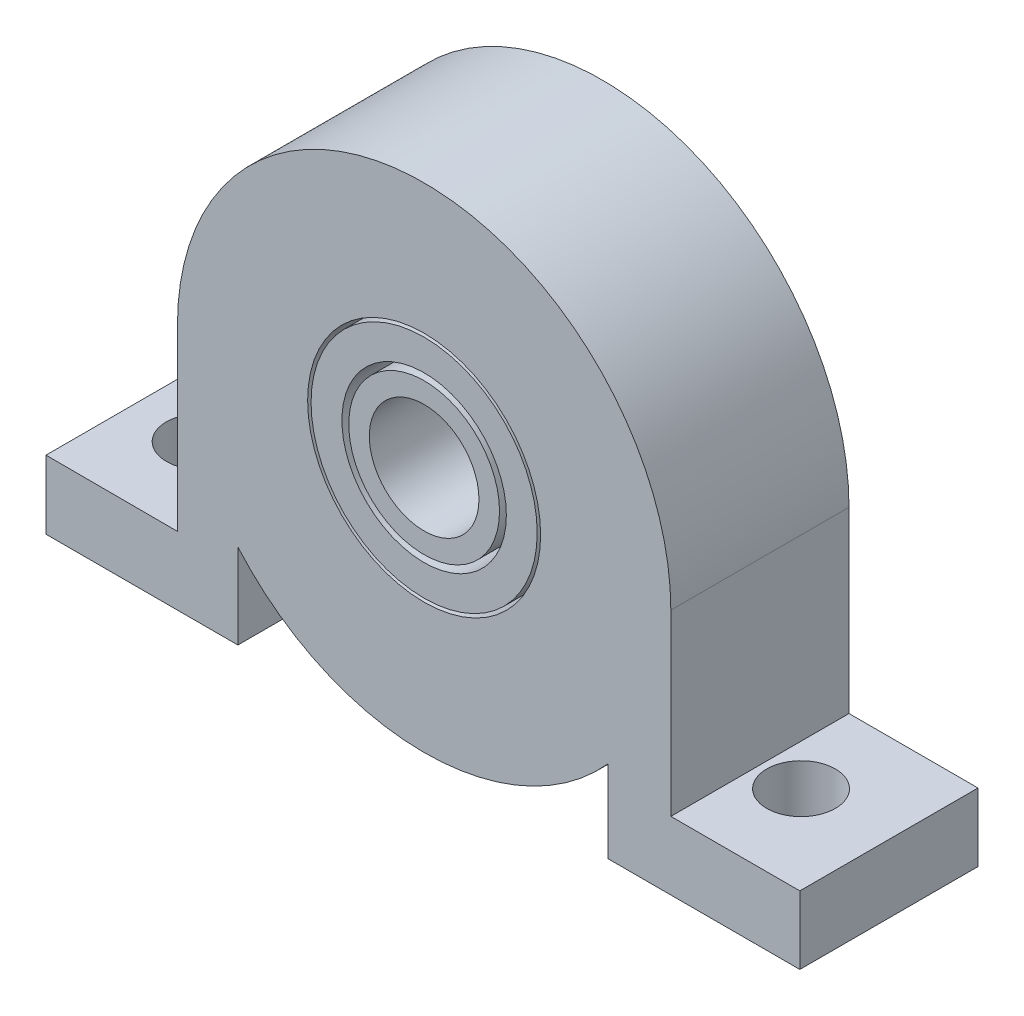
from build123d import *

# Parameters (mm, degrees)
BOSS_EXTRUDE1_DEPTH = 13
SKETCH2_R           = 4
CUT_EXTRUDE1_DEPTH  = 46.30956121
SKETCH3_R           = 6
SKETCH3_R_2         = 5.5
CUT_EXTRUDE3_DEPTH  = 46.30956121
SKETCH4_R           = 8.5
SKETCH4_R_2         = 8.25
CUT_EXTRUDE4_DEPTH  = 46.30956121
SKETCH5_R           = 2.5
CUT_EXTRUDE5_DEPTH  = 13
SKETCH6_R           = 2.5
CUT_EXTRUDE6_DEPTH  = 13


with BuildPart() as part:
    # Sketch1 → Boss-Extrude1 (new body)
    with BuildSketch(Plane.XY):
        with BuildLine():
            Line((13.41081623, -2.491892385), (27.41081623, -2.491892385))
            Line((27.41081623, -2.491892385), (27.41081623, 2.475781987))
            Line((27.41081623, 2.475781987), (18, 2.475781987))
            Line((18, 2.475781987), (18, 15.508107615))
            ThreePointArc((18, 15.508107615), (0, 33.508107615), (-18, 15.508107615))
            Line((-18, 15.508107615), (-18, 2.485966445))
            Line((-18, 2.485966445), (-27.58918377, 2.508107615))
            Line((-27.58918377, 2.508107615), (-27.58918377, -2.491892385))
            Line((-27.58918377, -2.491892385), (-13.58918377, -2.491892385))
            Line((-13.58918377, -2.491892385), (-13.58918377, 3.704121659))
            ThreePointArc((-13.58918377, 3.704121659), (-0.134838052, -2.491387341), (13.41081623, 3.501858907))
            Line((13.41081623, 3.501858907), (13.41081623, -2.491892385))
        make_face()
    extrude(amount=BOSS_EXTRUDE1_DEPTH)

    # Sketch2 → Cut-Extrude1 (cut, through all)
    with BuildSketch(Plane.XY.offset(13)):
        with Locations((0, 15.508107615)):
            Circle(SKETCH2_R)
    extrude(amount=-CUT_EXTRUDE1_DEPTH, mode=Mode.SUBTRACT)

    # Sketch3 → Cut-Extrude3 (cut, through all)
    with BuildSketch(Plane.XY.offset(13)):
        with Locations((0, 15.508107615)):
            Circle(SKETCH3_R)
        with Locations((0, 15.508107615)):
            Circle(SKETCH3_R_2, mode=Mode.SUBTRACT)
    extrude(amount=-CUT_EXTRUDE3_DEPTH, mode=Mode.SUBTRACT)


with BuildPart() as cut_extrude3_piece_1:
    # of the separate pieces the step leaves, piece 1, a body of its own (cut_extrude3_pieces)
    add(part.part.solids().sort_by_distance((-13.58918377, 3.704121659, 0))[0])

    # Sketch4 → Cut-Extrude4 (cut, through all)
    with BuildSketch(Plane.XY.offset(13)):
        with Locations((0, 15.508107615)):
            Circle(SKETCH4_R)
        with Locations((0, 15.508107615)):
            Circle(SKETCH4_R_2, mode=Mode.SUBTRACT)
    extrude(amount=-CUT_EXTRUDE4_DEPTH, mode=Mode.SUBTRACT)


with BuildPart() as cut_extrude3_piece_2:
    # of the separate pieces the step leaves, piece 2, a body of its own (cut_extrude3_pieces)
    add(part.part.solids().sort_by_distance((5.5, 15.508107615, 0))[0])


with BuildPart() as cut_extrude4_piece_1:
    # of the separate pieces the step leaves, piece 1, a body of its own (cut_extrude4_pieces)
    add(cut_extrude3_piece_1.part.solids().sort_by_distance((-13.58918377, 3.704121659, 0))[0])

    # Sketch5 → Cut-Extrude5 (cut)
    with BuildSketch(Plane(origin=(0, 2.475781987, 0), x_dir=(1, 0, 0), z_dir=(0, 1, 0))):
        with Locations(Location((21, -6.5, 0), (0, 0, 180))):
            Circle(SKETCH5_R)
        with Locations(Location((-21, -6.5, 0), (0, 0, 180))):
            Circle(SKETCH5_R)
    extrude(amount=-CUT_EXTRUDE5_DEPTH, mode=Mode.SUBTRACT)

    # Sketch6 → Cut-Extrude6 (cut)
    with BuildSketch(Plane(origin=(0.005644036, 2.44439189, 0), x_dir=(0.9999973343314404, -0.002308967304544804, 0), z_dir=(0.002308967304544804, 0.9999973343314404, 0))):
        with Locations(Location((-22.815354539, -6.5, 0), (0, 0, 180))):
            Circle(SKETCH6_R)
    extrude(amount=-CUT_EXTRUDE6_DEPTH, mode=Mode.SUBTRACT)


with BuildPart() as cut_extrude4_piece_2:
    # of the separate pieces the step leaves, piece 2, a body of its own (cut_extrude4_pieces)
    add(cut_extrude3_piece_1.part.solids().sort_by_distance((8.25, 15.508107615, 0))[0])


solid = Compound([cut_extrude3_piece_2.part, cut_extrude4_piece_1.part, cut_extrude4_piece_2.part])
